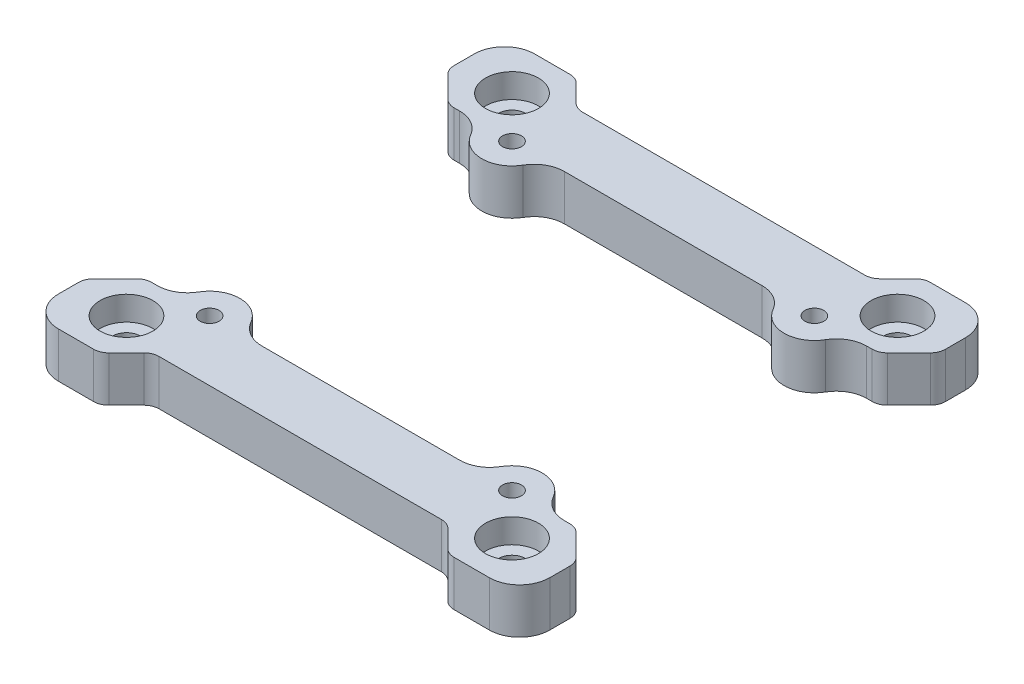
from build123d import *

# Parameters (mm, degrees)
BOSS_EXTRUDE1_DEPTH               = 1.5
BOSS_EXTRUDE1_2_DEPTH             = 1.5
FILLET1_R                         = 1
FILLET2_R                         = 2
CBORE_FOR_M1_6_SHCS1_AT_2_COUNT   = 2
CBORE_FOR_M1_6_SHCS1_AT_2_PITCH   = 25.5
CBORE_FOR_M1_6_SHCS1_AT_3_COUNT   = 2
CBORE_FOR_M1_6_SHCS1_AT_3_PITCH   = 25.5
CBORE_FOR_M1_6_SHCS1_AT_4_COUNT   = 2
CBORE_FOR_M1_6_SHCS1_AT_4_PITCH   = 36.062445841
SKETCH6_W                         = 0.625
SKETCH6_H                         = 3
M1_6X0_35_TAPPED_HOLE1_AT_2_COUNT = 2
M1_6X0_35_TAPPED_HOLE1_AT_2_PITCH = 20
M1_6X0_35_TAPPED_HOLE1_AT_3_COUNT = 2
M1_6X0_35_TAPPED_HOLE1_AT_3_PITCH = 20
M1_6X0_35_TAPPED_HOLE1_AT_4_COUNT = 2
M1_6X0_35_TAPPED_HOLE1_AT_4_PITCH = 28.284271247
FILLET3_R                         = 1
FILLET4_R                         = 2


with BuildPart() as part:
    # Sketch1 → Boss-Extrude1 (new, symmetric)
    with BuildSketch(Plane(origin=(0, 0, 0), x_dir=(1, 0, 0), z_dir=(0, 1, 0))):
        with BuildLine():
            Line((9.757359313, -1.25), (-9.757359313, -1.25))
            Line((-9.757359313, -1.25), (-11.507359313, -3))
            Line((-11.507359313, -3), (-16.25, -3))
            Line((-16.25, -3), (-16.25, 0.742640687))
            Line((-16.25, 0.742640687), (-14.242640687, 2.75))
            Line((-14.242640687, 2.75), (-12, 2.75))
            ThreePointArc((-12, 2.75), (-10, 4.75), (-8, 2.75))
            Line((-8, 2.75), (8, 2.75))
            ThreePointArc((8, 2.75), (10, 4.75), (12, 2.75))
            Line((12, 2.75), (14.242640687, 2.75))
            Line((14.242640687, 2.75), (16.25, 0.742640687))
            Line((16.25, 0.742640687), (16.25, -3))
            Line((16.25, -3), (11.507359313, -3))
            Line((11.507359313, -3), (9.757359313, -1.25))
        make_face()
    extrude(amount=BOSS_EXTRUDE1_DEPTH, both=True)

    # Fillet1
    fillet1_edges = [part.edges().sort_by_distance(p)[0] for p in [
        (-11.507359313, 0, 3),
        (-16.25, 0, -0.742640687),
        (-14.242640687, 0, -2.75),
        (14.242640687, 0, -2.75),
        (16.25, 0, -0.742640687),
        (11.507359313, 0, 3),
        (9.757359313, 0, 1.25),
        (-9.757359313, 0, 1.25),
    ]]
    fillet(fillet1_edges, radius=FILLET1_R)

    # Fillet2
    fillet2_edges = [part.edges().sort_by_distance(p)[0] for p in [
        (-16.25, 0, 3),
        (-12, 0, -2.75),
        (-8, 0, -2.75),
        (8, 0, -2.75),
        (12, 0, -2.75),
        (16.25, 0, 3),
    ]]
    fillet(fillet2_edges, radius=FILLET2_R)

    # Sketch3 → CBORE for M1.6 SHCS1 (revolve, cut)
    with BuildSketch(Plane(origin=(-12.75, 1.5, 0), x_dir=(0, 0, 1), z_dir=(1, 0, 0))):
        Polygon((0, 0), (0, 3), (0.9, 3), (0.9, 1.6), (1.75, 1.6), (1.75, 0), align=None)
    cbore_for_m1_6_shcs1 = revolve(axis=Axis((-12.75, 7.85, 0), (0, -1, 0)), mode=Mode.SUBTRACT)

    # CBORE for M1.6 SHCS1 at 2: CBORE for M1.6 SHCS1 ×2
    with Locations(*[(i * CBORE_FOR_M1_6_SHCS1_AT_2_PITCH, 0, 0) for i in range(1, CBORE_FOR_M1_6_SHCS1_AT_2_COUNT)]):
        add(cbore_for_m1_6_shcs1, mode=Mode.SUBTRACT)

    # Sketch6 → M1.6x0.35 Tapped Hole1 (revolve, cut)
    with BuildSketch(Plane(origin=(-10, 1.5, -2.75), x_dir=(0, 0, 1), z_dir=(1, 0, 0))):
        with Locations((0.3125, 1.5)):
            Rectangle(SKETCH6_W, SKETCH6_H)
    m1_6x0_35_tapped_hole1 = revolve(axis=Axis((-10, 7.85, -2.75), (0, -1, 0)), mode=Mode.SUBTRACT)

    # M1.6x0.35 Tapped Hole1 at 2: M1.6x0.35 Tapped Hole1 ×2
    with Locations(*[(i * M1_6X0_35_TAPPED_HOLE1_AT_2_PITCH, 0, 0) for i in range(1, M1_6X0_35_TAPPED_HOLE1_AT_2_COUNT)]):
        add(m1_6x0_35_tapped_hole1, mode=Mode.SUBTRACT)


with BuildPart() as body_2:
    # Sketch1 → Boss-Extrude1 2 (new, symmetric)
    with BuildSketch(Plane(origin=(0, 0, 0), x_dir=(1, 0, 0), z_dir=(0, 1, 0))):
        with BuildLine():
            Line((9.757359313, 26.75), (11.507359313, 28.5))
            Line((11.507359313, 28.5), (16.25, 28.5))
            Line((16.25, 28.5), (16.25, 24.757359313))
            Line((16.25, 24.757359313), (14.242640687, 22.75))
            Line((14.242640687, 22.75), (12, 22.75))
            ThreePointArc((12, 22.75), (10, 20.75), (8, 22.75))
            Line((8, 22.75), (-8, 22.75))
            ThreePointArc((-8, 22.75), (-10, 20.75), (-12, 22.75))
            Line((-12, 22.75), (-14.242640687, 22.75))
            Line((-14.242640687, 22.75), (-16.25, 24.757359313))
            Line((-16.25, 24.757359313), (-16.25, 28.5))
            Line((-16.25, 28.5), (-11.507359313, 28.5))
            Line((-11.507359313, 28.5), (-9.757359313, 26.75))
            Line((-9.757359313, 26.75), (9.757359313, 26.75))
        make_face()
    extrude(amount=BOSS_EXTRUDE1_2_DEPTH, both=True)

    # CBORE for M1.6 SHCS1 at 3: CBORE for M1.6 SHCS1 ×2
    with Locations(*[(0, 0, -i * CBORE_FOR_M1_6_SHCS1_AT_3_PITCH) for i in range(1, CBORE_FOR_M1_6_SHCS1_AT_3_COUNT)]):
        add(cbore_for_m1_6_shcs1, mode=Mode.SUBTRACT)

    # CBORE for M1.6 SHCS1 at 4: CBORE for M1.6 SHCS1 ×2
    with Locations(*[Vector(0.7071067811865476, 0, -0.7071067811865476) * (i * CBORE_FOR_M1_6_SHCS1_AT_4_PITCH) for i in range(1, CBORE_FOR_M1_6_SHCS1_AT_4_COUNT)]):
        add(cbore_for_m1_6_shcs1, mode=Mode.SUBTRACT)

    # M1.6x0.35 Tapped Hole1 at 3: M1.6x0.35 Tapped Hole1 ×2
    with Locations(*[(0, 0, -i * M1_6X0_35_TAPPED_HOLE1_AT_3_PITCH) for i in range(1, M1_6X0_35_TAPPED_HOLE1_AT_3_COUNT)]):
        add(m1_6x0_35_tapped_hole1, mode=Mode.SUBTRACT)

    # M1.6x0.35 Tapped Hole1 at 4: M1.6x0.35 Tapped Hole1 ×2
    with Locations(*[Vector(0.7071067811865476, 0, -0.7071067811865476) * (i * M1_6X0_35_TAPPED_HOLE1_AT_4_PITCH) for i in range(1, M1_6X0_35_TAPPED_HOLE1_AT_4_COUNT)]):
        add(m1_6x0_35_tapped_hole1, mode=Mode.SUBTRACT)

    # Fillet3
    fillet3_edges = [body_2.edges().sort_by_distance(p)[0] for p in [
        (-14.242640687, 0, -22.75),
        (-16.25, 0, -24.757359313),
        (-11.507359313, 0, -28.5),
        (-9.757359313, 0, -26.75),
        (9.757359313, 0, -26.75),
        (11.507359313, 0, -28.5),
        (16.25, 0, -24.757359313),
        (14.242640687, 0, -22.75),
    ]]
    fillet(fillet3_edges, radius=FILLET3_R)

    # Fillet4
    fillet4_edges = [body_2.edges().sort_by_distance(p)[0] for p in [
        (8, 0, -22.75),
        (-8, 0, -22.75),
        (-12, 0, -22.75),
        (-16.25, 0, -28.5),
        (16.25, 0, -28.5),
        (12, 0, -22.75),
    ]]
    fillet(fillet4_edges, radius=FILLET4_R)


solid = Compound([part.part, body_2.part])
